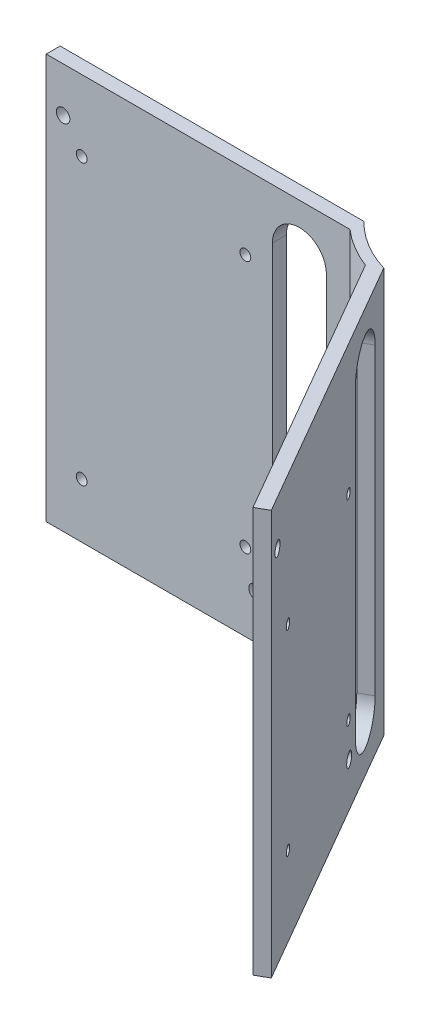
from build123d import *

# Parameters (mm, degrees)
BOSS_EXTRU_1_DEPTH      = 120
ENL_V_MAT_EXTRU_1_DEPTH = 188.009777727
ENL_V_MAT_EXTRU_2_DEPTH = 180.784310366
ESQUISSE6_R             = 2
ENL_V_MAT_EXTRU_3_DEPTH = 188.009777727
ESQUISSE7_R             = 2
ENL_V_MAT_EXTRU_4_DEPTH = 180.784310366
ESQUISSE10_R            = 1.364499713
ENL_V_MAT_EXTRU_5_DEPTH = 180.784310366
ENL_V_MAT_EXTRU_6_DEPTH = 188.009777727
ESQUISSE11_R            = 2
ENL_V_MAT_EXTRU_7_DEPTH = 188.009777727
ESQUISSE12_R            = 2
ENL_V_MAT_EXTRU_8_DEPTH = 180.784310366


with BuildPart() as part:
    # Esquisse3 → Boss.-Extru.1 (new body)
    with BuildSketch(Plane(origin=(0, 0, 0), x_dir=(1, 0, 0), z_dir=(0, 1, 0))):
        with BuildLine():
            ThreePointArc((-25, -28.618176043), (-27.104360033, -26.633694209), (-29.051678093, -24.494897428))
            Line((-29.051678093, -24.494897428), (-115, -24.494897428))
            Line((-115, -24.494897428), (-115, -28.618176043))
            Line((-115, -28.618176043), (-25, -28.618176043))
        make_face()
        with BuildLine():
            ThreePointArc((-10.103808925, -33.509894736), (-18.121448463, -29.943498553), (-25, -24.494897428))
            Line((-25, -24.494897428), (-29.051678093, -24.494897428))
            ThreePointArc((-29.051678093, -24.494897428), (-27.104360033, -26.633694209), (-25, -28.618176043))
            ThreePointArc((-25, -28.618176043), (-19.581111, -32.566548666), (-13.552631037, -35.50107311))
            ThreePointArc((-13.552631037, -35.50107311), (-10.809506446, -36.430132725), (-8.003591765, -37.147577564))
            Line((-8.003591765, -37.147577564), (-10.103808925, -33.509894736))
        make_face()
        with BuildLine():
            Line((35.411933246, -112.345472721), (-8.003591765, -37.147577564))
            ThreePointArc((-8.003591765, -37.147577564), (-10.809506446, -36.430132725), (-13.552631037, -35.50107311))
            Line((-13.552631037, -35.50107311), (31.963111135, -114.336651096))
            Line((31.963111135, -114.336651096), (35.411933246, -112.345472721))
        make_face()
    extrude(amount=BOSS_EXTRU_1_DEPTH)

    # Esquisse4 → Enlèv. mat.-Extru.1 (cut, through all)
    with BuildSketch(Plane.XY.offset(28.618176043)):
        with BuildLine():
            Line((-48, 105), (-48, 15))
            ThreePointArc((-48, 15), (-40, 7), (-32, 15))
            Line((-32, 15), (-32, 105))
            ThreePointArc((-32, 105), (-40, 113), (-48, 105))
        make_face()
    extrude(amount=-ENL_V_MAT_EXTRU_1_DEPTH, mode=Mode.SUBTRACT)

    # Esquisse5 → Enlèv. mat.-Extru.2 (cut, through all)
    with BuildSketch(Plane(origin=(-25.536888865, 0, 14.743729661), x_dir=(0.4999999999999999, 0, 0.8660254037844386), z_dir=(-0.8660254037844387, 0, 0.49999999999999994))):
        with BuildLine():
            Line((46.968515657, 105), (46.968515657, 15))
            ThreePointArc((46.968515657, 15), (38.968515657, 7), (30.968515657, 15))
            Line((30.968515657, 15), (30.968515657, 105))
            ThreePointArc((30.968515657, 105), (38.968515657, 113), (46.968515657, 105))
        make_face()
    extrude(amount=-ENL_V_MAT_EXTRU_2_DEPTH, mode=Mode.SUBTRACT)

    # Esquisse6 → Enlèv. mat.-Extru.3 (cut, through all)
    with BuildSketch(Plane.XY.offset(28.618176043)):
        with Locations((-110, 106.75)):
            Circle(ESQUISSE6_R)
    extrude(amount=-ENL_V_MAT_EXTRU_3_DEPTH, mode=Mode.SUBTRACT)

    # Esquisse7 → Enlèv. mat.-Extru.4 (cut, through all)
    with BuildSketch(Plane(origin=(-25.536888865, 0, 14.743729661), x_dir=(0.4999999999999999, 0, 0.8660254037844386), z_dir=(-0.8660254037844387, 0, 0.49999999999999994))):
        with Locations((110, 106.75)):
            Circle(ESQUISSE7_R)
    extrude(amount=-ENL_V_MAT_EXTRU_4_DEPTH, mode=Mode.SUBTRACT)

    # Esquisse10 → Enlèv. mat.-Extru.5 (cut, through all)
    with BuildSketch(Plane(origin=(-25.536888865, 0, 14.743729661), x_dir=(0.4999999999999999, 0, 0.8660254037844386), z_dir=(-0.8660254037844387, 0, 0.49999999999999994))):
        with Locations((101.5, 23.5)):
            Circle(ESQUISSE10_R)
        with Locations((52.5, 23.5)):
            Circle(ESQUISSE10_R)
        with Locations((52.5, 81.585512482)):
            Circle(ESQUISSE10_R)
        with Locations((101.5, 81.585512482)):
            Circle(ESQUISSE10_R)
    extrude(amount=-ENL_V_MAT_EXTRU_5_DEPTH, mode=Mode.SUBTRACT)

    # Esquisse9 → Enlèv. mat.-Extru.6 (cut, through all)
    with BuildSketch(Plane.XY.offset(28.618176043)):
        with BuildLine():
            ThreePointArc((-54.4, 23), (-56, 24.6), (-57.6, 23))
            ThreePointArc((-57.6, 23), (-56, 21.4), (-54.4, 23))
        make_face()
        with BuildLine():
            ThreePointArc((-106.1, 16.2), (-104.5, 14.6), (-102.9, 16.2))
            ThreePointArc((-102.9, 16.2), (-104.5, 17.8), (-106.1, 16.2))
        make_face()
        with BuildLine():
            ThreePointArc((-57.6, 98), (-56, 96.4), (-54.4, 98))
            ThreePointArc((-54.4, 98), (-56, 99.6), (-57.6, 98))
        make_face()
        with BuildLine():
            ThreePointArc((-106.1, 99), (-104.5, 97.4), (-102.9, 99))
            ThreePointArc((-102.9, 99), (-104.5, 100.6), (-106.1, 99))
        make_face()
    extrude(amount=-ENL_V_MAT_EXTRU_6_DEPTH, mode=Mode.SUBTRACT)

    # Esquisse11 → Enlèv. mat.-Extru.7 (cut, through all)
    with BuildSketch(Plane.XY.offset(28.618176043)):
        with Locations((-53, 13)):
            Circle(ESQUISSE11_R)
    extrude(amount=-ENL_V_MAT_EXTRU_7_DEPTH, mode=Mode.SUBTRACT)

    # Esquisse12 → Enlèv. mat.-Extru.8 (cut, through all)
    with BuildSketch(Plane(origin=(-25.536888865, 0, 14.743729661), x_dir=(0.4999999999999999, 0, 0.8660254037844386), z_dir=(-0.8660254037844387, 0, 0.49999999999999994))):
        with Locations((51.968515657, 13)):
            Circle(ESQUISSE12_R)
    extrude(amount=-ENL_V_MAT_EXTRU_8_DEPTH, mode=Mode.SUBTRACT)


solid = part.part
